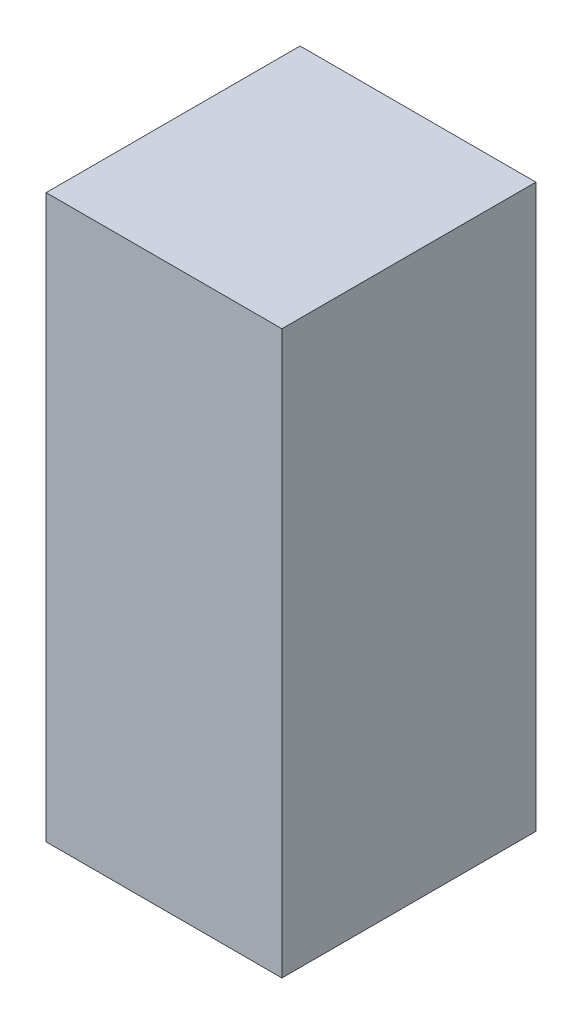
from build123d import *

# Parameters (mm, degrees)
SKETCH1_W           = 130
SKETCH1_H           = 310
BOSS_EXTRUDE1_DEPTH = 140


with BuildPart() as part:
    # Sketch1 → Boss-Extrude1 (new body)
    with BuildSketch(Plane.XY):
        with Locations((-65, 155)):
            Rectangle(SKETCH1_W, SKETCH1_H)
    extrude(amount=BOSS_EXTRUDE1_DEPTH)


solid = part.part
